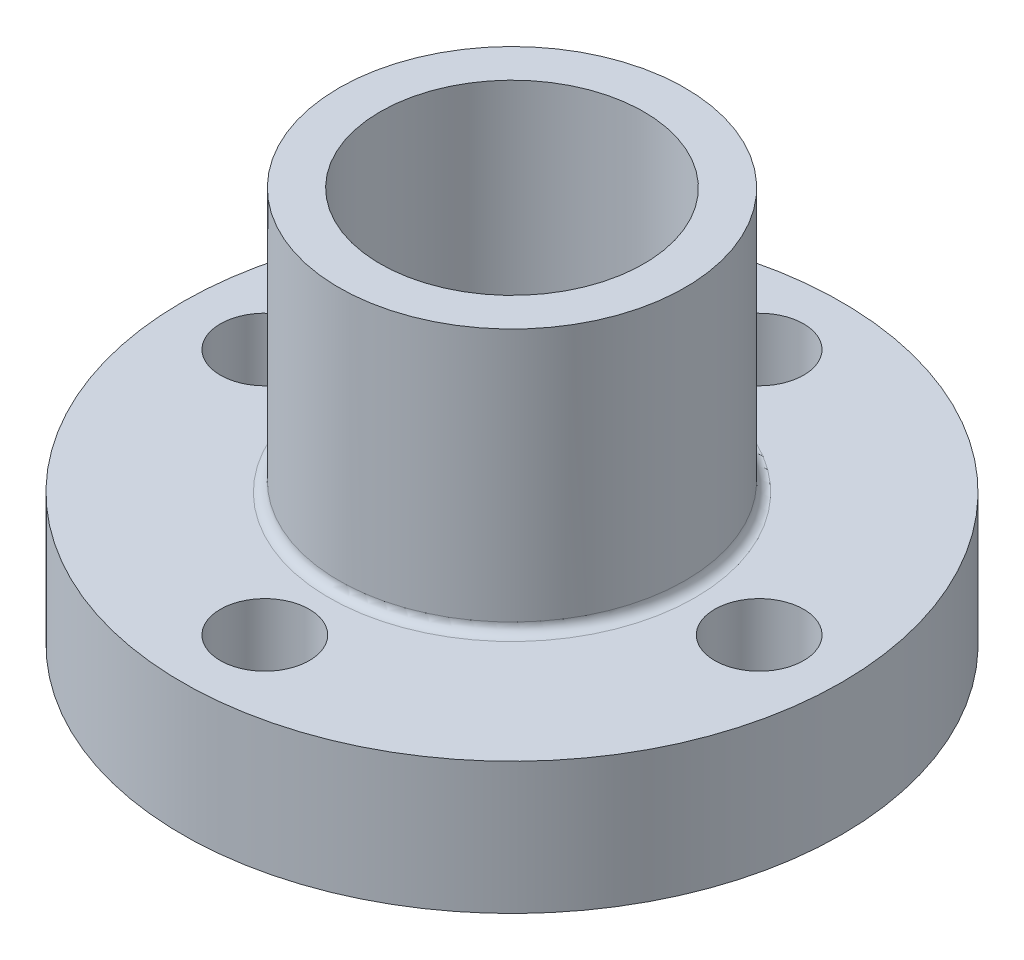
from build123d import *

# Parameters (mm, degrees)
SKETCH3_R          = 1.35
CUT_EXTRUDE1_DEPTH = 10
FILLET1_R          = 0.3


with BuildPart() as part:
    # Sketch2 → Revolve1 (revolve)
    with BuildSketch(Plane.XY, mode=Mode.PRIVATE) as revolve1_sk:
        Polygon((4, 12), (4, 0), (10, 0), (10, 4), (5.25, 4), (5.25, 12), align=None)
    revolve(revolve1_sk.sketch.rotate(Axis((0, 12, 0), (0, -1, 0)), 180), axis=Axis((0, 12, 0), (0, -1, 0)))

    # Sketch3 → Cut-Extrude1 (cut)
    with BuildSketch(Plane(origin=(0, 4, 0), x_dir=(1, 0, 0), z_dir=(0, 1, 0))):
        with Locations(Location((7.5, 0, 0), (0, 0, 180))):
            Circle(SKETCH3_R)
        with Locations(Location((0, -7.5, 0), (0, 0, 180))):
            Circle(SKETCH3_R)
        with Locations(Location((-7.5, 0, 0), (0, 0, 180))):
            Circle(SKETCH3_R)
        with Locations(Location((0, 7.5, 0), (0, 0, 180))):
            Circle(SKETCH3_R)
    extrude(amount=-CUT_EXTRUDE1_DEPTH, mode=Mode.SUBTRACT)

    # Fillet1
    fillet1_edges = [part.edges().sort_by_distance(p)[0] for p in [
        (5.25, 4, 0),
    ]]
    fillet(fillet1_edges, radius=FILLET1_R)


solid = part.part
